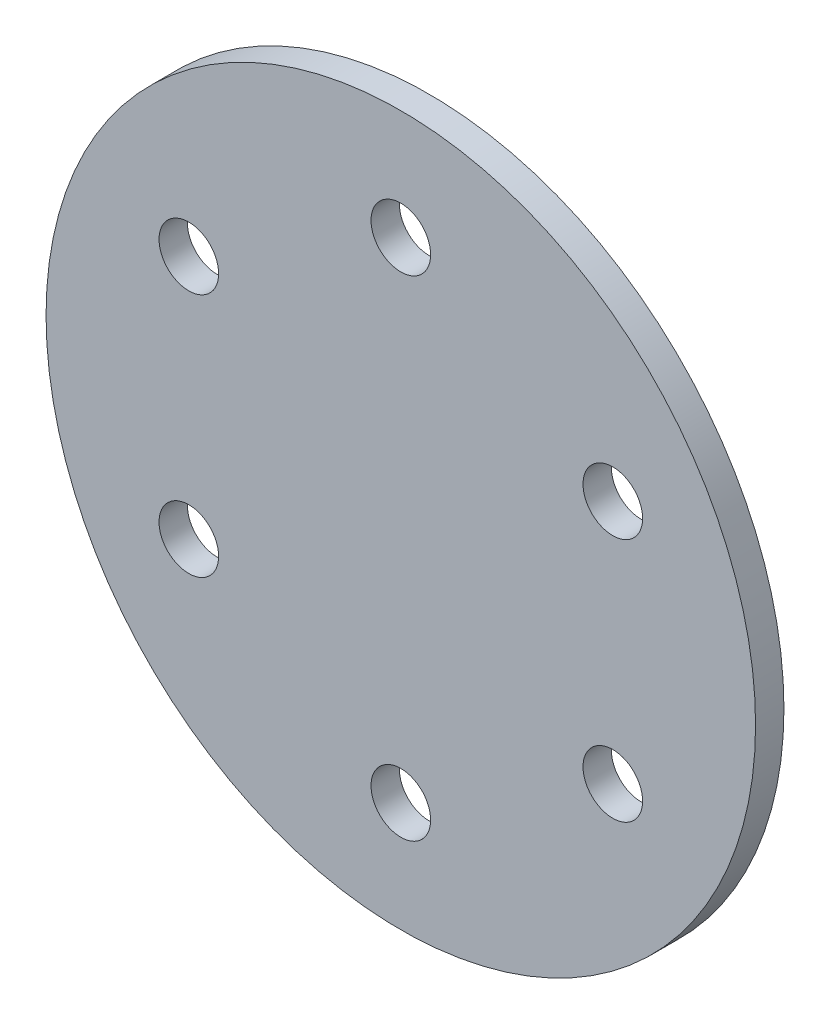
from build123d import *

# Parameters (mm, degrees)
SKETCH_1_R      = 25
SKETCH_1_R_2    = 2.1
EXTRUDE_1_DEPTH = 2


with BuildPart() as part:
    # 草图1 → 凸台-拉伸1 (new body)
    with BuildSketch(Plane.XY):
        Circle(SKETCH_1_R)
        with Locations((0, 17.25)):
            Circle(SKETCH_1_R_2, mode=Mode.SUBTRACT)
        with Locations((14.938938215, 8.625)):
            Circle(SKETCH_1_R_2, mode=Mode.SUBTRACT)
        with Locations((14.938938215, -8.625)):
            Circle(SKETCH_1_R_2, mode=Mode.SUBTRACT)
        with Locations((0, -17.25)):
            Circle(SKETCH_1_R_2, mode=Mode.SUBTRACT)
        with Locations((-14.938938215, -8.625)):
            Circle(SKETCH_1_R_2, mode=Mode.SUBTRACT)
        with Locations((-14.938938215, 8.625)):
            Circle(SKETCH_1_R_2, mode=Mode.SUBTRACT)
    extrude(amount=EXTRUDE_1_DEPTH)


solid = part.part
